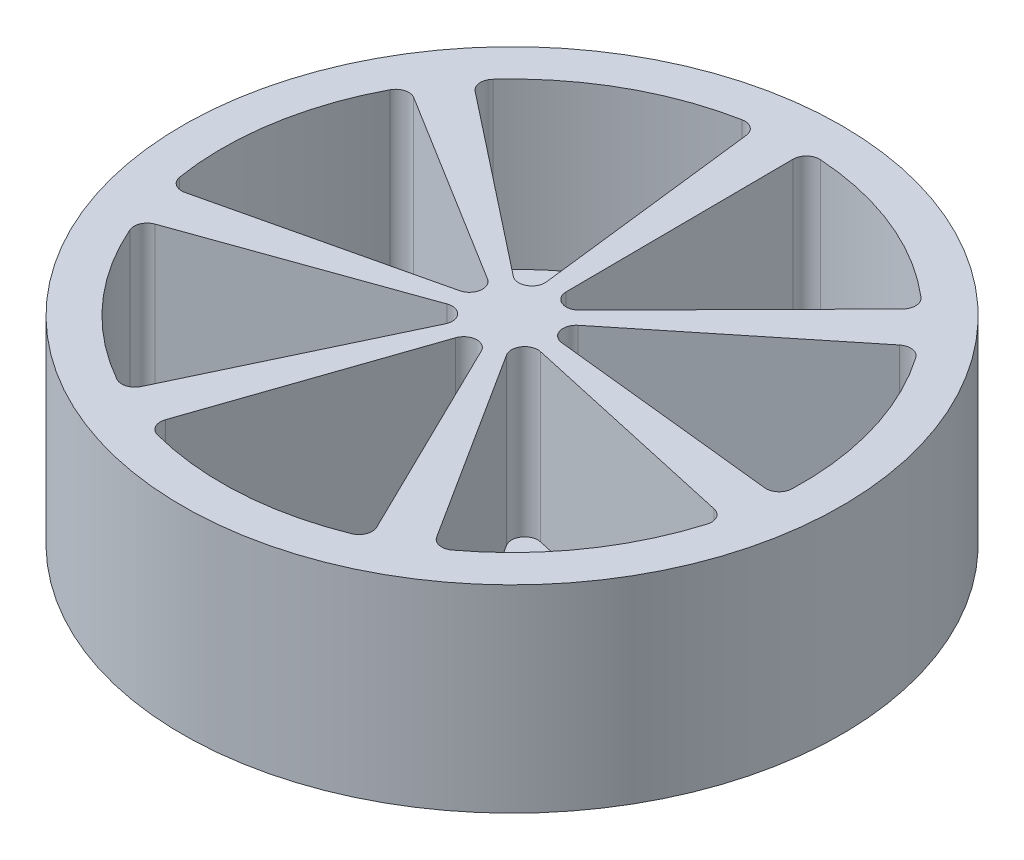
from build123d import *

# Parameters (mm, degrees)
SKETCH1_R               = 63.5
BOSS_EXTRUDE1_DEPTH     = 38.1
CUT_EXTRUDE2_DEPTH      = 31.75
SKETCH4_R               = 6.35
BOSS_EXTRUDE2_DEPTH     = 6.35
CUT_EXTRUDE3_DEPTH      = 98.550550998
CUT_EXTRUDE3_DEPTH_BACK = 15.24
SKETCH3_R               = 2.94
CUT_EXTRUDE4_REACH      = 103.798
CUT_EXTRUDE4_END_RADIUS = 2.94
SKETCH5_R               = 1.263861724


with BuildPart() as part:
    # Sketch1 → Boss-Extrude1 (new body)
    with BuildSketch(Plane(origin=(0, 0, 0), x_dir=(1, 0, 0), z_dir=(0, 1, 0))):
        with Locations(Location((0, 0, 0), (0, 0, 90))):
            Circle(SKETCH1_R)
    extrude(amount=BOSS_EXTRUDE1_DEPTH)

    # Sketch2 → Cut-Extrude2 (cut)
    with BuildSketch(Plane(origin=(0, 38.1, 0), x_dir=(1, 0, 0), z_dir=(0, 1, 0))):
        with BuildLine():
            Line((-1.7819572, -9.111319007), (-16.057301334, -50.738697991))
            ThreePointArc((-16.057301334, -50.738697991), (-15.89484722, -52.75977688), (-14.304875125, -54.018005773))
            ThreePointArc((-14.304875125, -54.018005773), (3.484226214, -55.771270092), (20.916794468, -51.817584942))
            ThreePointArc((20.916794468, -51.817584942), (22.337802979, -50.371249564), (22.247447967, -48.345666393))
            Line((22.247447967, -48.345666393), (2.902107489, -8.818689111))
            ThreePointArc((2.902107489, -8.818689111), (0.462316687, -7.400205158), (-1.7819572, -9.111319007))
        make_face()
        with BuildLine():
            Line((8.704163204, -3.229403726), (51.669220951, -12.749274735))
            ThreePointArc((51.669220951, -12.749274735), (53.309221074, -13.941562792), (53.554027291, -15.954327341))
            ThreePointArc((53.554027291, -15.954327341), (45.776114287, -32.048740393), (33.314033776, -44.863677441))
            ThreePointArc((33.314033776, -44.863677441), (31.338979429, -45.322274799), (29.657547842, -44.189164464))
            Line((29.657547842, -44.189164464), (6.012483905, -7.074004722))
            ThreePointArc((6.012483905, -7.074004722), (6.073963109, -4.252498707), (8.704163204, -3.229403726))
        make_face()
        with BuildLine():
            Line((7.951806494, 4.791688532), (42.1830167, 32.447580836))
            ThreePointArc((42.1830167, 32.447580836), (44.13770839, 32.986405118), (45.863985261, 31.922864157))
            ThreePointArc((45.863985261, 31.922864157), (53.597654639, 15.807144497), (55.846795761, -1.926084944))
            ThreePointArc((55.846795761, -1.926084944), (54.973915369, -3.756175388), (53.039658589, -4.3642888))
            Line((53.039658589, -4.3642888), (9.279401997, 0.290179402))
            ThreePointArc((9.279401997, 0.290179402), (7.111791423, 2.097426005), (7.951806494, 4.791688532))
        make_face()
        with BuildLine():
            Line((1.211577307, 9.204541593), (0.932140496, 53.210746228))
            ThreePointArc((0.932140496, 53.210746228), (1.729601044, 55.074937175), (3.637426875, 55.761487836))
            ThreePointArc((3.637426875, 55.761487836), (21.059067856, 51.759927174), (36.325781471, 42.461888801))
            ThreePointArc((36.325781471, 42.461888801), (37.212371773, 40.638400701), (36.481824607, 38.746985345))
            Line((36.481824607, 38.746985345), (5.55874112, 7.435852518))
            ThreePointArc((5.55874112, 7.435852518), (2.794295742, 6.867946156), (1.211577307, 9.204541593))
        make_face()
        with BuildLine():
            Line((-6.440994304, 6.686187096), (-41.020656513, 33.905134408))
            ThreePointArc((-41.020656513, 33.905134408), (-41.980931166, 35.690918215), (-41.328188139, 37.610573848))
            ThreePointArc((-41.328188139, 37.610573848), (-27.33742655, 48.736428979), (-10.549287178, 54.875194214))
            ThreePointArc((-10.549287178, 54.875194214), (-8.570846762, 54.431432191), (-7.547567398, 52.680989231))
            Line((-7.547567398, 52.680989231), (-2.347765198, 8.982177024))
            ThreePointArc((-2.347765198, 8.982177024), (-3.627361626, 6.466762771), (-6.440994304, 6.686187096))
        make_face()
        with BuildLine():
            Line((-9.243365832, -0.867002658), (-52.084062499, -10.931735159))
            ThreePointArc((-52.084062499, -10.931735159), (-54.078965953, -10.569090123), (-55.172834542, -8.861869364))
            ThreePointArc((-55.172834542, -8.861869364), (-55.148281182, 9.013405721), (-49.480527415, 25.966359134))
            ThreePointArc((-49.480527415, 25.966359134), (-47.900042872, 27.236485042), (-45.89348721, 26.94513373))
            Line((-45.89348721, 26.94513373), (-8.486356436, 3.764739028))
            ThreePointArc((-8.486356436, 3.764739028), (-7.317541705, 1.195975121), (-9.243365832, -0.867002658))
        make_face()
        with BuildLine():
            Line((-5.085294358, -7.767321727), (-23.927107102, -47.536785185))
            ThreePointArc((-23.927107102, -47.536785185), (-25.454436367, -48.870358028), (-27.471211214, -48.661144195))
            ThreePointArc((-27.471211214, -48.661144195), (-41.431355264, -37.496895885), (-51.15192129, -22.495673991))
            ThreePointArc((-51.15192129, -22.495673991), (-51.159529717, -20.468090867), (-49.680675096, -19.080957051))
            Line((-49.680675096, -19.080957051), (-8.234548188, -4.287624243))
            ThreePointArc((-8.234548188, -4.287624243), (-5.49746363, -4.975406188), (-5.085294358, -7.767321727))
        make_face()
    extrude(amount=-CUT_EXTRUDE2_DEPTH, mode=Mode.SUBTRACT)

    # Sketch4 → Boss-Extrude2 (add)
    with BuildSketch(Plane.XZ):
        with Locations(Location((0, 0, 0), (0, 0, 90))):
            Circle(SKETCH4_R)
    extrude(amount=BOSS_EXTRUDE2_DEPTH)

    # Sketch3 → Cut-Extrude3 (cut, two sides: drawn at the far end of the back side and taken through both)
    with BuildSketch(Plane.XZ.offset(-CUT_EXTRUDE3_DEPTH_BACK)):
        with Locations(Location((0, 0, 0), (0, 0, 270))):
            Circle(SKETCH3_R)
    extrude(amount=CUT_EXTRUDE3_DEPTH + CUT_EXTRUDE3_DEPTH_BACK, mode=Mode.SUBTRACT)

    # Cut-Extrude4: up to this cylinder (the profile starts outside it)
    cut_extrude4_end = Plane(origin=(0, -3.175, 0), z_dir=(0, 1, 0)) * Cylinder(CUT_EXTRUDE4_END_RADIUS, 214.476, mode=Mode.PRIVATE)
    # Sketch5 → Cut-Extrude4 (cut, up to the surface)
    with BuildSketch(Plane.XY.offset(6.35), mode=Mode.PRIVATE) as cut_extrude4_sk1:
        with Locations((0, -3.175)):
            Circle(SKETCH5_R)
    cut_extrude4_tool1 = extrude(cut_extrude4_sk1.sketch, amount=-CUT_EXTRUDE4_REACH, mode=Mode.PRIVATE) - cut_extrude4_end
    add(cut_extrude4_tool1.solids().sort_by_distance((0, -3.175, 6.35))[0], mode=Mode.SUBTRACT)


solid = part.part
